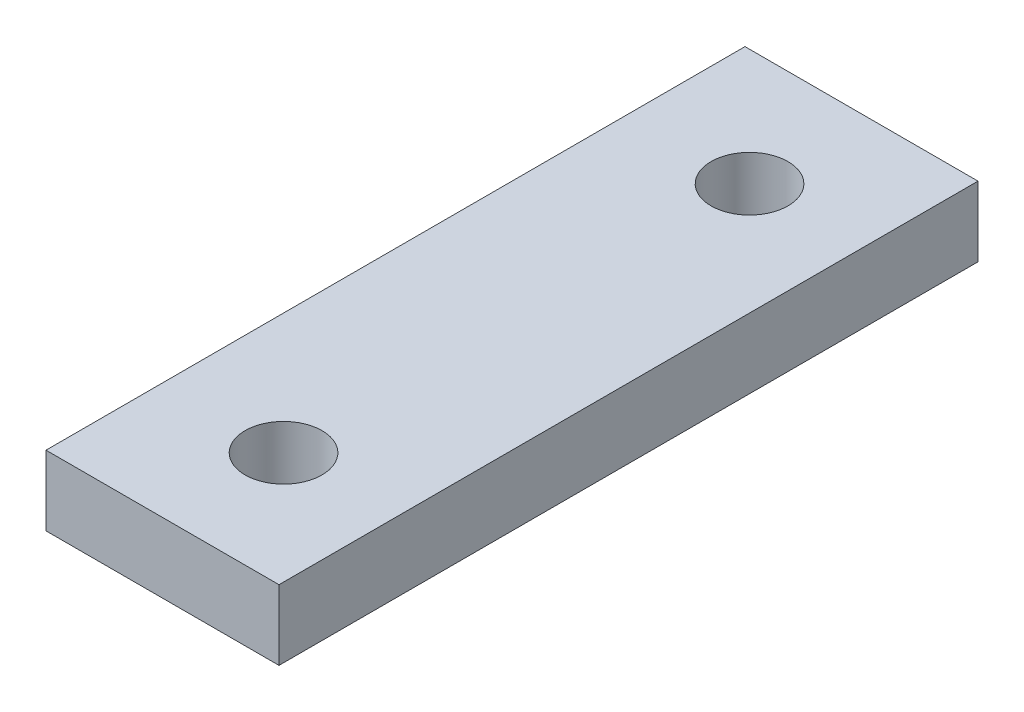
from build123d import *

# Parameters (mm, degrees)
SKETCH1_W           = 10
SKETCH1_H           = 30
SKETCH1_R           = 1.65
BOSS_EXTRUDE1_DEPTH = 3


with BuildPart() as part:
    # Sketch1 → Boss-Extrude1 (new body)
    with BuildSketch(Plane(origin=(0, 0, 0), x_dir=(1, 0, 0), z_dir=(0, 1, 0))):
        with Locations((5, 15)):
            Rectangle(SKETCH1_W, SKETCH1_H)
        with Locations(Location((5.194465668, 25, 0), (0, 0, 270))):
            Circle(SKETCH1_R, mode=Mode.SUBTRACT)
        with Locations(Location((5.194465668, 5, 0), (0, 0, 90))):
            Circle(SKETCH1_R, mode=Mode.SUBTRACT)
    extrude(amount=BOSS_EXTRUDE1_DEPTH)


solid = part.part
